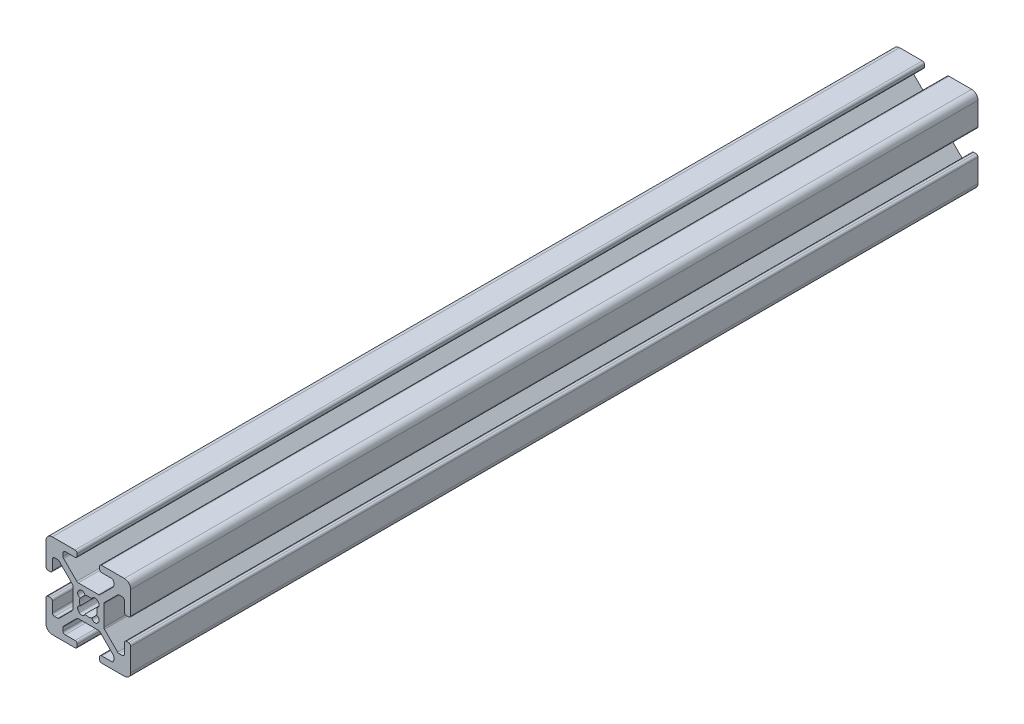
from build123d import *

# Parameters (mm, degrees)
BOSS_EXTRUDE1_DEPTH = 200


with BuildPart() as part:
    # Sketch2 → Boss-Extrude1 (new body)
    with BuildSketch(Plane.XY):
        with BuildLine():
            Line((-10, -3.138), (-10, -8.5))
            ThreePointArc((-10, -8.5), (-9.560660172, -9.560660172), (-8.5, -10))
            Line((-8.5, -10), (-3.138, -10))
            ThreePointArc((-3.138, -10), (-2.778789755, -9.851210245), (-2.63, -9.492))
            Line((-2.63, -9.492), (-2.63, -9.008))
            ThreePointArc((-2.63, -9.008), (-2.778789755, -8.648789755), (-3.138, -8.5))
            Line((-3.138, -8.5), (-5.487, -8.5))
            ThreePointArc((-5.487, -8.5), (-5.846210245, -8.351210245), (-5.995, -7.992))
            Line((-5.995, -7.992), (-5.995, -7.266240833))
            ThreePointArc((-5.995, -7.266240833), (-5.956330803, -7.07183765), (-5.846210245, -6.907030588))
            Line((-5.846210245, -6.907030588), (-2.742969412, -3.803789755))
            ThreePointArc((-2.742969412, -3.803789755), (-2.57816235, -3.693669197), (-2.383759167, -3.655))
            Line((-2.383759167, -3.655), (2.38407951, -3.655))
            ThreePointArc((2.38407951, -3.655), (2.578482694, -3.693669197), (2.743289755, -3.803789755))
            Line((2.743289755, -3.803789755), (5.846210245, -6.906710245))
            ThreePointArc((5.846210245, -6.906710245), (5.956330803, -7.071517306), (5.995, -7.26592049))
            Line((5.995, -7.26592049), (5.995, -7.992))
            ThreePointArc((5.995, -7.992), (5.846210245, -8.351210245), (5.487, -8.5))
            Line((5.487, -8.5), (3.138, -8.5))
            ThreePointArc((3.138, -8.5), (2.778789755, -8.648789755), (2.63, -9.008))
            Line((2.63, -9.008), (2.63, -9.492))
            ThreePointArc((2.63, -9.492), (2.778789755, -9.851210245), (3.138, -10))
            Line((3.138, -10), (8.5, -10))
            ThreePointArc((8.5, -10), (9.560660172, -9.560660172), (10, -8.5))
            Line((10, -8.5), (10, -3.138))
            ThreePointArc((10, -3.138), (9.851210245, -2.778789755), (9.492, -2.63))
            Line((9.492, -2.63), (9.008, -2.63))
            ThreePointArc((9.008, -2.63), (8.648789755, -2.778789755), (8.5, -3.138))
            Line((8.5, -3.138), (8.5, -5.487))
            ThreePointArc((8.5, -5.487), (8.351210245, -5.846210245), (7.992, -5.995))
            Line((7.992, -5.995), (7.266240833, -5.995))
            ThreePointArc((7.266240833, -5.995), (7.07183765, -5.956330803), (6.907030588, -5.846210245))
            Line((6.907030588, -5.846210245), (3.803789755, -2.742969412))
            ThreePointArc((3.803789755, -2.742969412), (3.693669197, -2.57816235), (3.655, -2.383759167))
            Line((3.655, -2.383759167), (3.655, 2.38407951))
            ThreePointArc((3.655, 2.38407951), (3.693669197, 2.578482694), (3.803789755, 2.743289755))
            Line((3.803789755, 2.743289755), (6.906710245, 5.846210245))
            ThreePointArc((6.906710245, 5.846210245), (7.071517306, 5.956330803), (7.26592049, 5.995))
            Line((7.26592049, 5.995), (7.992, 5.995))
            ThreePointArc((7.992, 5.995), (8.351210245, 5.846210245), (8.5, 5.487))
            Line((8.5, 5.487), (8.5, 3.138))
            ThreePointArc((8.5, 3.138), (8.648789755, 2.778789755), (9.008, 2.63))
            Line((9.008, 2.63), (9.492, 2.63))
            ThreePointArc((9.492, 2.63), (9.851210245, 2.778789755), (10, 3.138))
            Line((10, 3.138), (10, 8.5))
            ThreePointArc((10, 8.5), (9.560660172, 9.560660172), (8.5, 10))
            Line((8.5, 10), (3.138, 10))
            ThreePointArc((3.138, 10), (2.778789755, 9.851210245), (2.63, 9.492))
            Line((2.63, 9.492), (2.63, 9.008))
            ThreePointArc((2.63, 9.008), (2.778789755, 8.648789755), (3.138, 8.5))
            Line((3.138, 8.5), (5.487, 8.5))
            ThreePointArc((5.487, 8.5), (5.846210245, 8.351210245), (5.995, 7.992))
            Line((5.995, 7.992), (5.995, 7.266240833))
            ThreePointArc((5.995, 7.266240833), (5.956330803, 7.07183765), (5.846210245, 6.907030588))
            Line((5.846210245, 6.907030588), (2.742969412, 3.803789755))
            ThreePointArc((2.742969412, 3.803789755), (2.57816235, 3.693669197), (2.383759167, 3.655))
            Line((2.383759167, 3.655), (-2.38407951, 3.655))
            ThreePointArc((-2.38407951, 3.655), (-2.578482694, 3.693669197), (-2.743289755, 3.803789755))
            Line((-2.743289755, 3.803789755), (-5.846210245, 6.906710245))
            ThreePointArc((-5.846210245, 6.906710245), (-5.956330803, 7.071517306), (-5.995, 7.26592049))
            Line((-5.995, 7.26592049), (-5.995, 7.992))
            ThreePointArc((-5.995, 7.992), (-5.846210245, 8.351210245), (-5.487, 8.5))
            Line((-5.487, 8.5), (-3.138, 8.5))
            ThreePointArc((-3.138, 8.5), (-2.778789755, 8.648789755), (-2.63, 9.008))
            Line((-2.63, 9.008), (-2.63, 9.492))
            ThreePointArc((-2.63, 9.492), (-2.778789755, 9.851210245), (-3.138, 10))
            Line((-3.138, 10), (-8.5, 10))
            ThreePointArc((-8.5, 10), (-9.560660172, 9.560660172), (-10, 8.5))
            Line((-10, 8.5), (-10, 3.138))
            ThreePointArc((-10, 3.138), (-9.851210245, 2.778789755), (-9.492, 2.63))
            Line((-9.492, 2.63), (-9.008, 2.63))
            ThreePointArc((-9.008, 2.63), (-8.648789755, 2.778789755), (-8.5, 3.138))
            Line((-8.5, 3.138), (-8.5, 5.487))
            ThreePointArc((-8.5, 5.487), (-8.351210245, 5.846210245), (-7.992, 5.995))
            Line((-7.992, 5.995), (-7.266240833, 5.995))
            ThreePointArc((-7.266240833, 5.995), (-7.07183765, 5.956330803), (-6.907030588, 5.846210245))
            Line((-6.907030588, 5.846210245), (-3.803789755, 2.742969412))
            ThreePointArc((-3.803789755, 2.742969412), (-3.693669197, 2.57816235), (-3.655, 2.383759167))
            Line((-3.655, 2.383759167), (-3.655, -2.38407951))
            ThreePointArc((-3.655, -2.38407951), (-3.693669197, -2.578482694), (-3.803789755, -2.743289755))
            Line((-3.803789755, -2.743289755), (-6.906710245, -5.846210245))
            ThreePointArc((-6.906710245, -5.846210245), (-7.071517306, -5.956330803), (-7.26592049, -5.995))
            Line((-7.26592049, -5.995), (-7.992, -5.995))
            ThreePointArc((-7.992, -5.995), (-8.351210245, -5.846210245), (-8.5, -5.487))
            Line((-8.5, -5.487), (-8.5, -3.138))
            ThreePointArc((-8.5, -3.138), (-8.648789755, -2.778789755), (-9.008, -2.63))
            Line((-9.008, -2.63), (-9.492, -2.63))
            ThreePointArc((-9.492, -2.63), (-9.851210245, -2.778789755), (-10, -3.138))
        make_face()
        with BuildLine():
            Line((-2.124493037, 2.304493037), (-2.304493037, 2.124493037))
            ThreePointArc((-2.304493037, 2.124493037), (-2.506016078, 1.35638567), (-1.935777391, 0.803729988))
            ThreePointArc((-1.935777391, 0.803729988), (-2.096, 0), (-1.935777391, -0.803729988))
            ThreePointArc((-1.935777391, -0.803729988), (-2.506016078, -1.35638567), (-2.304493037, -2.124493037))
            Line((-2.304493037, -2.124493037), (-2.124493037, -2.304493037))
            ThreePointArc((-2.124493037, -2.304493037), (-1.35638567, -2.506016078), (-0.803729988, -1.935777391))
            ThreePointArc((-0.803729988, -1.935777391), (0, -2.096), (0.803729988, -1.935777391))
            ThreePointArc((0.803729988, -1.935777391), (1.35638567, -2.506016078), (2.124493037, -2.304493037))
            Line((2.124493037, -2.304493037), (2.304493037, -2.124493037))
            ThreePointArc((2.304493037, -2.124493037), (2.506016078, -1.35638567), (1.935777391, -0.803729988))
            ThreePointArc((1.935777391, -0.803729988), (2.096, 0), (1.935777391, 0.803729988))
            ThreePointArc((1.935777391, 0.803729988), (2.506016078, 1.35638567), (2.304493037, 2.124493037))
            Line((2.304493037, 2.124493037), (2.124493037, 2.304493037))
            ThreePointArc((2.124493037, 2.304493037), (1.35638567, 2.506016078), (0.803729988, 1.935777391))
            ThreePointArc((0.803729988, 1.935777391), (0, 2.096), (-0.803729988, 1.935777391))
            ThreePointArc((-0.803729988, 1.935777391), (-1.35638567, 2.506016078), (-2.124493037, 2.304493037))
        make_face(mode=Mode.SUBTRACT)
    extrude(amount=-BOSS_EXTRUDE1_DEPTH)


solid = part.part
